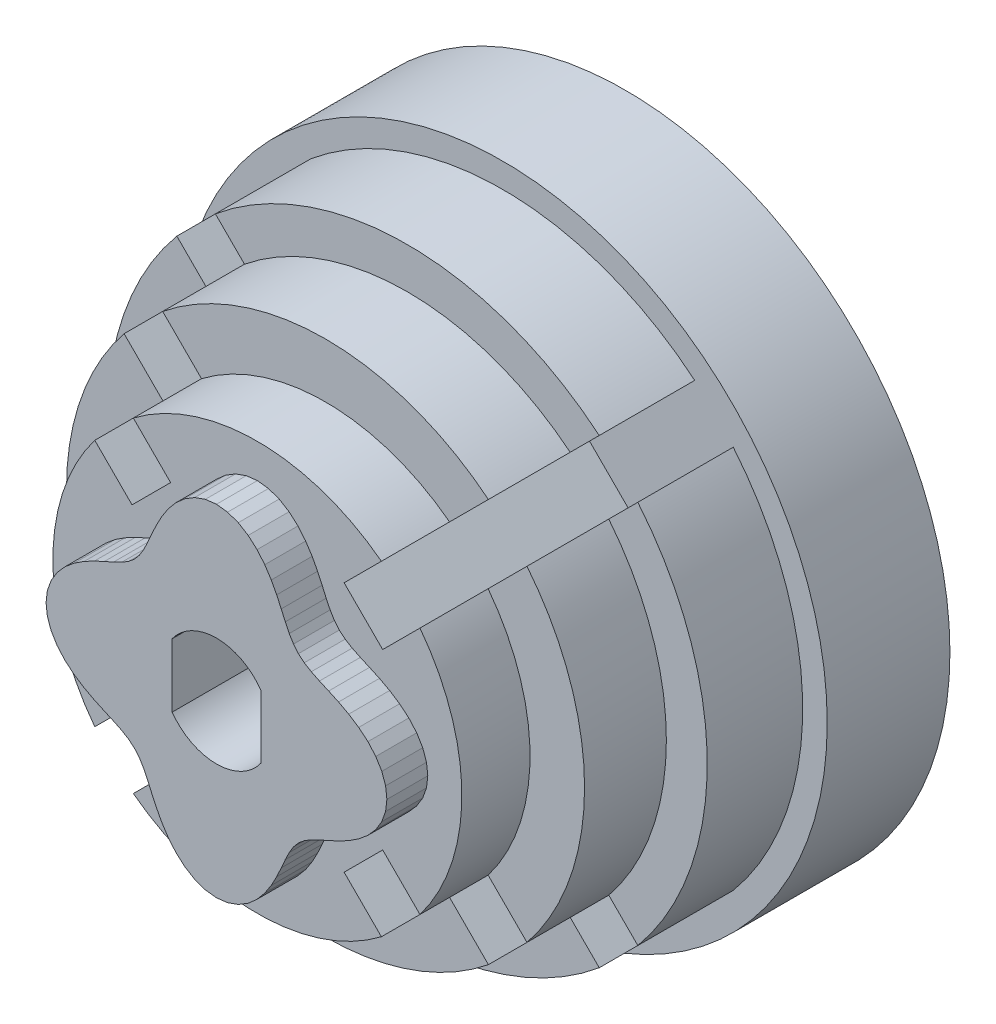
from build123d import *

# Parameters (mm, degrees)
SKETCH1_R        = 23.8
STEP1_DEPTH      = 9
SKETCH2_R        = 22
STEP2_DEPTH      = 7
SKETCH3_R        = 19
STEP3_DEPTH      = 6
SKETCH4_R        = 15
STEP4_DEPTH      = 5
LOBED_TOP_DEPTH  = 3
FLUTES_DEPTH     = 18
SKETCH7_R        = 4
BORE_DEPTH       = 30
SKETCH8_W        = 1.2
SKETCH8_H        = 9
BORE_FLATS_DEPTH = 30


with BuildPart() as part:
    # Sketch1 → Step1 (new body)
    with BuildSketch(Plane.XY):
        Circle(SKETCH1_R)
    extrude(amount=STEP1_DEPTH)

    # Sketch2 → Step2 (add)
    with BuildSketch(Plane.XY.offset(9)):
        Circle(SKETCH2_R)
    extrude(amount=STEP2_DEPTH)

    # Sketch3 → Step3 (add)
    with BuildSketch(Plane.XY.offset(16)):
        Circle(SKETCH3_R)
    extrude(amount=STEP3_DEPTH)

    # Sketch4 → Step4 (add)
    with BuildSketch(Plane.XY.offset(22)):
        Circle(SKETCH4_R)
    extrude(amount=STEP4_DEPTH)

    # Sketch5 → Lobed_top (add)
    with BuildSketch(Plane.XY.offset(27)):
        Polygon((12.5, 0), (12.405234104, 0.813082), (12.127403917, 1.596603015), (11.68528529, 2.32434776), (11.108147002, 2.976419019), (10.432933463, 3.541503697), (9.700735091, 4.01817604), (8.952908293, 4.415085774), (8.227241336, 4.75), (7.554555327, 5.047792488), (6.956081779, 5.33758928), (6.441875004, 5.649372756), (6.01040764, 6.01040764), (5.649372756, 6.441875004), (5.33758928, 6.956081779), (5.047792488, 7.554555327), (4.75, 8.227241336), (4.415085774, 8.952908293), (4.01817604, 9.700735091), (3.541503697, 10.432933463), (2.976419019, 11.108147002), (2.32434776, 11.68528529), (1.596603015, 12.127403917), (0.813082, 12.405234104), (0, 12.5), (-0.813082, 12.405234104), (-1.596603015, 12.127403917), (-2.32434776, 11.68528529), (-2.976419019, 11.108147002), (-3.541503697, 10.432933463), (-4.01817604, 9.700735091), (-4.415085774, 8.952908293), (-4.75, 8.227241336), (-5.047792488, 7.554555327), (-5.33758928, 6.956081779), (-5.649372756, 6.441875004), (-6.01040764, 6.01040764), (-6.441875004, 5.649372756), (-6.956081779, 5.33758928), (-7.554555327, 5.047792488), (-8.227241336, 4.75), (-8.952908293, 4.415085774), (-9.700735091, 4.01817604), (-10.432933463, 3.541503697), (-11.108147002, 2.976419019), (-11.68528529, 2.32434776), (-12.127403917, 1.596603015), (-12.405234104, 0.813082), (-12.5, 0), (-12.405234104, -0.813082), (-12.127403917, -1.596603015), (-11.68528529, -2.32434776), (-11.108147002, -2.976419019), (-10.432933463, -3.541503697), (-9.700735091, -4.01817604), (-8.952908293, -4.415085774), (-8.227241336, -4.75), (-7.554555327, -5.047792488), (-6.956081779, -5.33758928), (-6.441875004, -5.649372756), (-6.01040764, -6.01040764), (-5.649372756, -6.441875004), (-5.33758928, -6.956081779), (-5.047792488, -7.554555327), (-4.75, -8.227241336), (-4.415085774, -8.952908293), (-4.01817604, -9.700735091), (-3.541503697, -10.432933463), (-2.976419019, -11.108147002), (-2.32434776, -11.68528529), (-1.596603015, -12.127403917), (-0.813082, -12.405234104), (0, -12.5), (0.813082, -12.405234104), (1.596603015, -12.127403917), (2.32434776, -11.68528529), (2.976419019, -11.108147002), (3.541503697, -10.432933463), (4.01817604, -9.700735091), (4.415085774, -8.952908293), (4.75, -8.227241336), (5.047792488, -7.554555327), (5.33758928, -6.956081779), (5.649372756, -6.441875004), (6.01040764, -6.01040764), (6.441875004, -5.649372756), (6.956081779, -5.33758928), (7.554555327, -5.047792488), (8.227241336, -4.75), (8.952908293, -4.415085774), (9.700735091, -4.01817604), (10.432933463, -3.541503697), (11.108147002, -2.976419019), (11.68528529, -2.32434776), (12.127403917, -1.596603015), (12.405234104, -0.813082), align=None)
    extrude(amount=LOBED_TOP_DEPTH)

    # Sketch6 → Flutes (cut)
    with BuildSketch(Plane.XY.offset(9)):
        Polygon((9.192388155, 6.363961031), (19.657568517, 16.829141392), (16.829141392, 19.657568517), (6.363961031, 9.192388155), align=None)
        Polygon((-6.363961031, 9.192388155), (-16.829141392, 19.657568517), (-19.657568517, 16.829141392), (-9.192388155, 6.363961031), align=None)
        Polygon((-9.192388155, -6.363961031), (-19.657568517, -16.829141392), (-16.829141392, -19.657568517), (-6.363961031, -9.192388155), align=None)
        Polygon((6.363961031, -9.192388155), (16.829141392, -19.657568517), (19.657568517, -16.829141392), (9.192388155, -6.363961031), align=None)
    extrude(amount=FLUTES_DEPTH, mode=Mode.SUBTRACT)

    # Sketch7 → Bore (cut)
    with BuildSketch(Plane.XY):
        Circle(SKETCH7_R)
    extrude(amount=BORE_DEPTH, mode=Mode.SUBTRACT)

    # Sketch8 → Bore_flats (add)
    with BuildSketch(Plane.XY):
        with Locations((3.85, 0)):
            Rectangle(SKETCH8_W, SKETCH8_H)
        with Locations((-3.85, 0)):
            Rectangle(SKETCH8_W, SKETCH8_H)
    extrude(amount=BORE_FLATS_DEPTH)


solid = part.part
